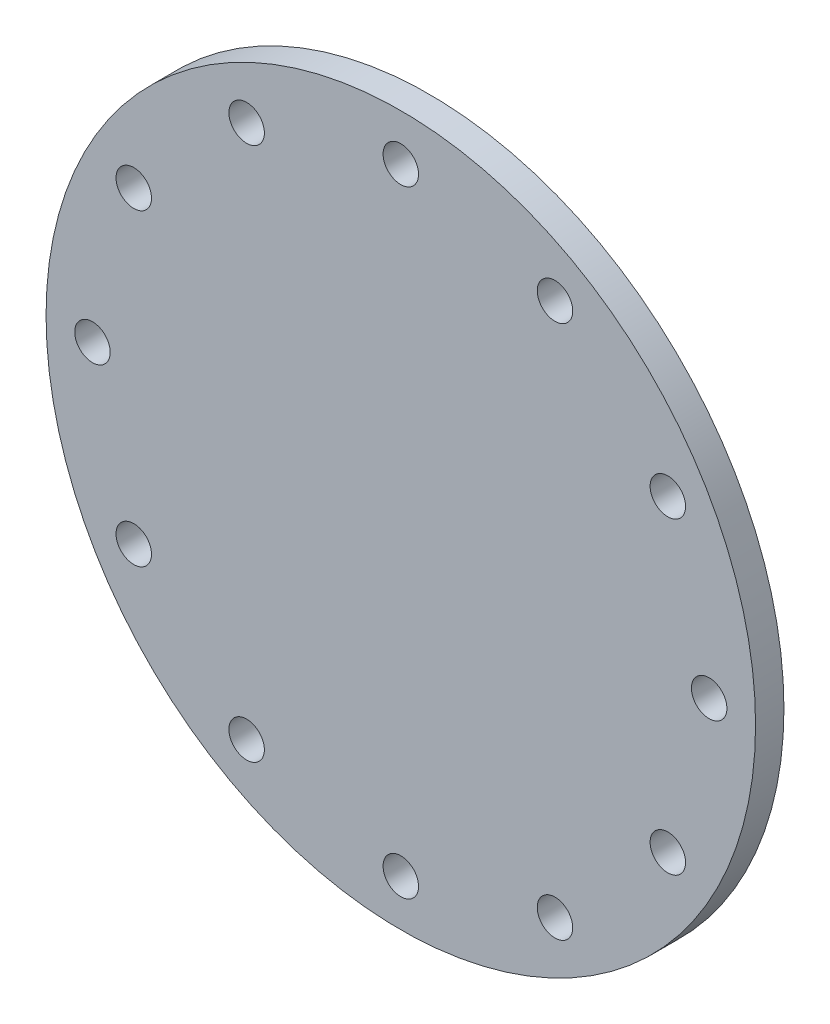
from build123d import *

# Parameters (mm, degrees)
SKETCH2_R           = 250
SKETCH2_R_2         = 12.5
BOSS_EXTRUDE1_DEPTH = 20


with BuildPart() as part:
    # Sketch2 → Boss-Extrude1 (new body)
    with BuildSketch(Plane.XY):
        Circle(SKETCH2_R)
        with Locations((0, 217.291387361)):
            Circle(SKETCH2_R_2, mode=Mode.SUBTRACT)
        with Locations((108.64569368, 188.179861478)):
            Circle(SKETCH2_R_2, mode=Mode.SUBTRACT)
        with Locations((188.179861478, 108.64569368)):
            Circle(SKETCH2_R_2, mode=Mode.SUBTRACT)
        with Locations((217.291387361, 0)):
            Circle(SKETCH2_R_2, mode=Mode.SUBTRACT)
        with Locations((188.179861478, -108.64569368)):
            Circle(SKETCH2_R_2, mode=Mode.SUBTRACT)
        with Locations((108.64569368, -188.179861478)):
            Circle(SKETCH2_R_2, mode=Mode.SUBTRACT)
        with Locations((0, -217.291387361)):
            Circle(SKETCH2_R_2, mode=Mode.SUBTRACT)
        with Locations((-108.64569368, -188.179861478)):
            Circle(SKETCH2_R_2, mode=Mode.SUBTRACT)
        with Locations((-188.179861478, -108.64569368)):
            Circle(SKETCH2_R_2, mode=Mode.SUBTRACT)
        with Locations((-217.291387361, 0)):
            Circle(SKETCH2_R_2, mode=Mode.SUBTRACT)
        with Locations((-188.179861478, 108.64569368)):
            Circle(SKETCH2_R_2, mode=Mode.SUBTRACT)
        with Locations((-108.64569368, 188.179861478)):
            Circle(SKETCH2_R_2, mode=Mode.SUBTRACT)
    extrude(amount=BOSS_EXTRUDE1_DEPTH)


solid = part.part
